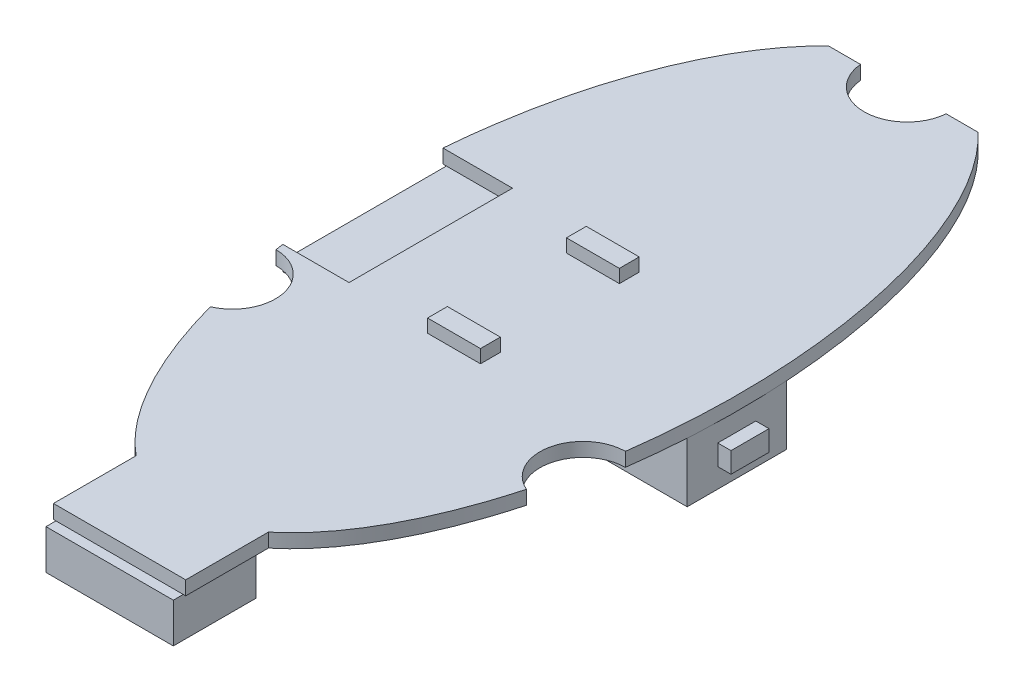
from build123d import *

# Parameters (mm, degrees)
BAREBOARD_DEPTH       = 1.0668
SKETCH2_W             = 9.779
SKETCH2_H             = 6.35
USB_DEPTH             = 3.048
SKETCH3_W             = 4.064
SKETCH3_H             = 1.524
SIDEFIRE_LEDS_DEPTH   = 1.016
SIDEFIRE_LEDS_2_DEPTH = 1.016
SKETCH4_W             = 20.32
SKETCH4_H             = 12.7
BLE_RADIO_DEPTH       = 2.794
SKETCH5_W             = 6.35
SKETCH5_H             = 12.7
CUT_EXTRUDE1_DEPTH    = 2.032
SKETCH6_W             = 12.7
SKETCH6_H             = 12.556872392
CUT_EXTRUDE2_DEPTH    = 1.0668
SKETCH7_W             = 6.35
SKETCH7_H             = 7.62
BOSS_EXTRUDE1_DEPTH   = 4.572
SKETCH8_W             = 2.921
SKETCH8_H             = 1.5748
BOSS_EXTRUDE2_DEPTH   = 1.016


with BuildPart() as part:
    # Sketch1 → BareBoard (new body)
    with BuildSketch(Plane(origin=(0, 0, 0), x_dir=(1, 0, 0), z_dir=(0, 1, 0))):
        with BuildLine():
            Line((-5.73230473, 26.637688011), (-3.289563717, 26.637688011))
            ThreePointArc((-3.289563717, 26.637688011), (0, 23.622), (3.289563717, 26.637688011))
            Line((3.289563717, 26.637688011), (5.73230473, 26.637688011))
            add(Edge.make_bspline(
                [(13.418222154, -8.128290216), (16.793446356, 16.231228563), (5.73230473, 26.637688011)],
                knots=[4.430395644, 4.430395644, 4.430395644, 5.860369829, 5.860369829, 5.860369829], degree=2, weights=[1, 0.755101704, 1]))
            ThreePointArc((13.418222154, -8.128290216), (10.225448258, -10.775831196), (12.139365996, -14.455531902))
            add(Edge.make_bspline(
                [(5.08, -27.210311989), (9.690192264, -23.447439252), (12.139365996, -14.455531902)],
                knots=[3.513761188, 3.513761188, 3.513761188, 4.194688818, 4.194688818, 4.194688818], degree=2, weights=[1, 0.942599888, 1]))
            Line((5.08, -27.210311989), (5.08, -33.560311989))
            Line((5.08, -33.560311989), (-5.08, -33.560311989))
            Line((-5.08, -33.560311989), (-5.08, -27.210311989))
            add(Edge.make_bspline(
                [(-12.139365996, -14.455531902), (-9.690192264, -23.447439252), (-5.08, -27.210311989)],
                knots=[2.088496489, 2.088496489, 2.088496489, 2.76942412, 2.76942412, 2.76942412], degree=2, weights=[1, 0.942599888, 1]))
            ThreePointArc((-12.139365996, -14.455531902), (-10.225448258, -10.775831196), (-13.418222154, -8.128290216))
            add(Edge.make_bspline(
                [(-5.73230473, 26.637688011), (-16.793446356, 16.231228563), (-13.418222154, -8.128290216)],
                knots=[0.422815478, 0.422815478, 0.422815478, 1.852789663, 1.852789663, 1.852789663], degree=2, weights=[1, 0.755101704, 1]))
        make_face()
    extrude(amount=BAREBOARD_DEPTH)

    # Sketch6 → Cut-Extrude2 (cut)
    with BuildSketch(Plane(origin=(0, 1.0668, 0), x_dir=(1, 0, 0), z_dir=(0, 1, 0))):
        with Locations((-14.770961261, -1.238442872)):
            Rectangle(SKETCH6_W, SKETCH6_H)
    extrude(amount=-CUT_EXTRUDE2_DEPTH, mode=Mode.SUBTRACT)


with BuildPart() as body_2:
    # Sketch2 → USB (new body)
    with BuildSketch(Plane.XZ):
        with Locations((0, 31.147311989)):
            Rectangle(SKETCH2_W, SKETCH2_H)
    extrude(amount=USB_DEPTH)


with BuildPart() as body_3:
    # Sketch3 → SideFire LEDs (new body)
    with BuildSketch(Plane(origin=(0, 1.0668, 0), x_dir=(1, 0, 0), z_dir=(0, 1, 0))):
        with Locations((0, 3.556)):
            Rectangle(SKETCH3_W, SKETCH3_H)
    extrude(amount=SIDEFIRE_LEDS_DEPTH)


with BuildPart() as body_4:
    # Sketch3 → SideFire LEDs 2 (new body)
    with BuildSketch(Plane(origin=(0, 1.0668, 0), x_dir=(1, 0, 0), z_dir=(0, 1, 0))):
        with Locations((0, -7.112)):
            Rectangle(SKETCH3_W, SKETCH3_H)
    extrude(amount=SIDEFIRE_LEDS_2_DEPTH)


with BuildPart() as body_5:
    # Sketch4 → BLE Radio (new body)
    with BuildSketch(Plane.XZ):
        with Locations((-3.339506125, 1.166879068)):
            Rectangle(SKETCH4_W, SKETCH4_H)
    extrude(amount=BLE_RADIO_DEPTH)

    # Sketch5 → Cut-Extrude1 (cut)
    with BuildSketch(Plane.XZ.offset(2.794)):
        with Locations((-10.324506125, 1.166879068)):
            Rectangle(SKETCH5_W, SKETCH5_H)
    extrude(amount=-CUT_EXTRUDE1_DEPTH, mode=Mode.SUBTRACT)


with BuildPart() as body_6:
    # Sketch7 → Boss-Extrude1 (new body)
    with BuildSketch(Plane.XZ):
        with Locations((10.668, 0)):
            Rectangle(SKETCH7_W, SKETCH7_H)
    extrude(amount=BOSS_EXTRUDE1_DEPTH)

    # Sketch8 → Boss-Extrude2 (add)
    with BuildSketch(Plane(origin=(13.843, 0, 0), x_dir=(0, 0, -1), z_dir=(1, 0, 0))):
        with Locations((0, -2.286)):
            Rectangle(SKETCH8_W, SKETCH8_H)
    extrude(amount=BOSS_EXTRUDE2_DEPTH)


solid = Compound([part.part, body_2.part, body_3.part, body_4.part, body_5.part, body_6.part])
